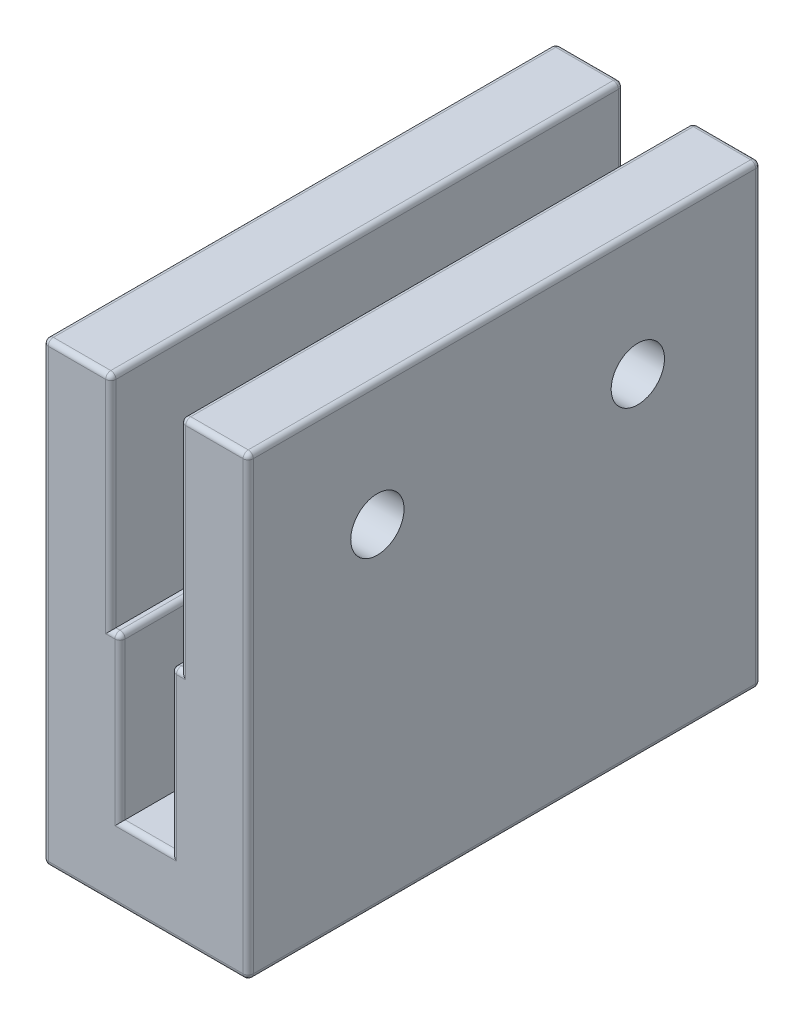
from build123d import *

# Parameters (mm, degrees)
SKETCH2_W               = 20
SKETCH2_H               = 50
BOSS_EXTRUDE1_DEPTH     = 44.5
SKETCH3_W               = 6.8
SKETCH3_H               = 21.48
SKETCH3_W_2             = 5
SKETCH3_H_2             = 15.77
CUT_EXTRUDE3_DEPTH      = 68.677544282
FILLET1_R               = 0.5
SKETCH7_W               = 4.6
SKETCH7_H               = 20.1
CUT_EXTRUDE4_DEPTH      = 3.25
CUT_EXTRUDE5_DEPTH      = 55.820160525
CUT_EXTRUDE5_DEPTH_BACK = 55.820160525
SKETCH8_R               = 2.6


with BuildPart() as part:
    # Sketch2 → Boss-Extrude1 (new body)
    with BuildSketch(Plane(origin=(0, 0, 0), x_dir=(1, 0, 0), z_dir=(0, 1, 0))):
        Rectangle(SKETCH2_W, SKETCH2_H)
    extrude(amount=BOSS_EXTRUDE1_DEPTH)

    # Sketch3 → Cut-Extrude3 (cut, through all)
    with BuildSketch(Plane.XY.offset(25)):
        with Locations((0, 33.76)):
            Rectangle(SKETCH3_W, SKETCH3_H)
        with Locations((0, 15.135)):
            Rectangle(SKETCH3_W_2, SKETCH3_H_2)
    extrude(amount=-CUT_EXTRUDE3_DEPTH, mode=Mode.SUBTRACT)

    # Fillet1
    fillet1_edges = [part.edges().sort_by_distance(p)[0] for p in [
        (-10, 44.5, 0),
        (-6.7, 44.5, -25),
        (6.7, 44.5, 25),
        (-6.7, 44.5, 25),
        (0, 7.25, -25),
        (-2.5, 15.135, 25),
        (2.5, 15.135, -25),
        (2.5, 23.02, 0),
        (-2.5, 15.135, -25),
        (3.4, 33.76, -25),
        (0, 7.25, 25),
        (2.5, 15.135, 25),
        (2.95, 23.02, 25),
        (-3.4, 33.76, 25),
        (-2.95, 23.02, 25),
        (-3.4, 44.5, 0),
        (3.4, 33.76, 25),
        (3.4, 44.5, 0),
        (-3.4, 33.76, -25),
        (-2.95, 23.02, -25),
        (-2.5, 23.02, 0),
        (2.95, 23.02, -25),
        (10, 44.5, 0),
        (0, 0, 25),
        (-10, 0, 0),
        (0, 0, -25),
        (10, 0, 0),
        (10, 22.25, 25),
        (-10, 22.25, 25),
        (-10, 22.25, -25),
        (10, 22.25, -25),
        (6.7, 44.5, -25),
    ]]
    fillet(fillet1_edges, radius=FILLET1_R)

    # Sketch7 → Cut-Extrude4 (cut)
    with BuildSketch(Plane.ZY.offset(10)):
        with Locations((16.3, 13.53)):
            Rectangle(SKETCH7_W, SKETCH7_H)
    extrude(amount=-CUT_EXTRUDE4_DEPTH, mode=Mode.SUBTRACT)

    # Sketch8 → Cut-Extrude5 (cut, two sides: drawn at the far end of the back side and taken through both)
    with BuildSketch(Plane.ZY.offset(10).offset(-CUT_EXTRUDE5_DEPTH_BACK)):
        with Locations((-13, 32.41)):
            Circle(SKETCH8_R)
        with Locations((12.4, 32.41)):
            Circle(SKETCH8_R)
    extrude(amount=CUT_EXTRUDE5_DEPTH + CUT_EXTRUDE5_DEPTH_BACK, mode=Mode.SUBTRACT)


solid = part.part
